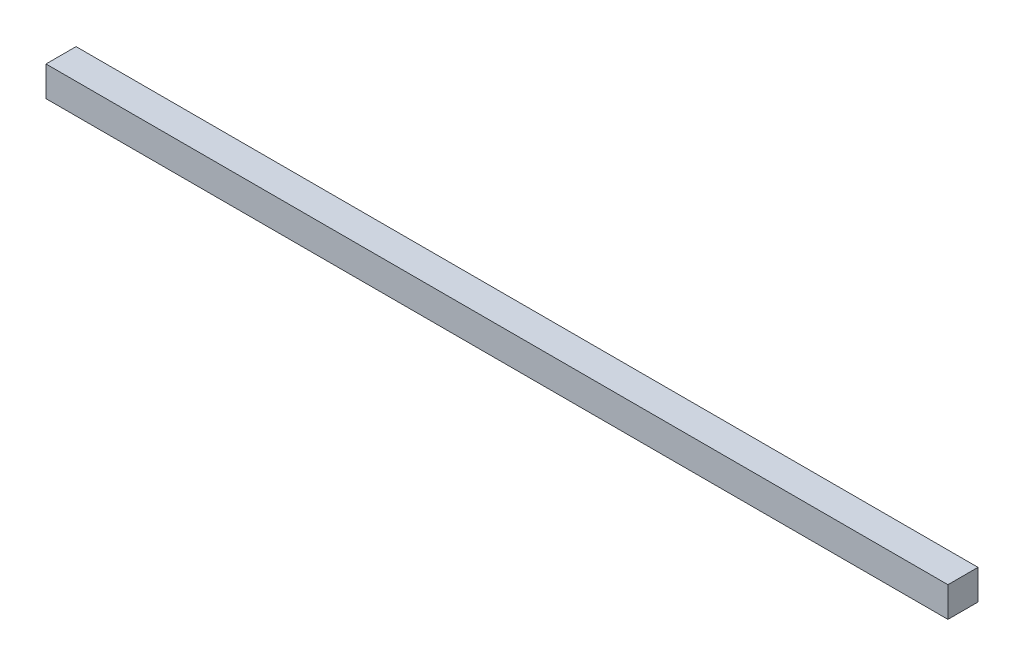
from build123d import *

# Parameters (mm, degrees)
SKETCH1_W           = 240
SKETCH1_H           = 8
BOSS_EXTRUDE1_DEPTH = 8


with BuildPart() as part:
    # Sketch1 → Boss-Extrude1 (new body)
    with BuildSketch(Plane(origin=(0, 490, 0), x_dir=(1, 0, 0), z_dir=(0, 1, 0))):
        with Locations((300, -152)):
            Rectangle(SKETCH1_W, SKETCH1_H)
    extrude(amount=BOSS_EXTRUDE1_DEPTH)


solid = part.part
